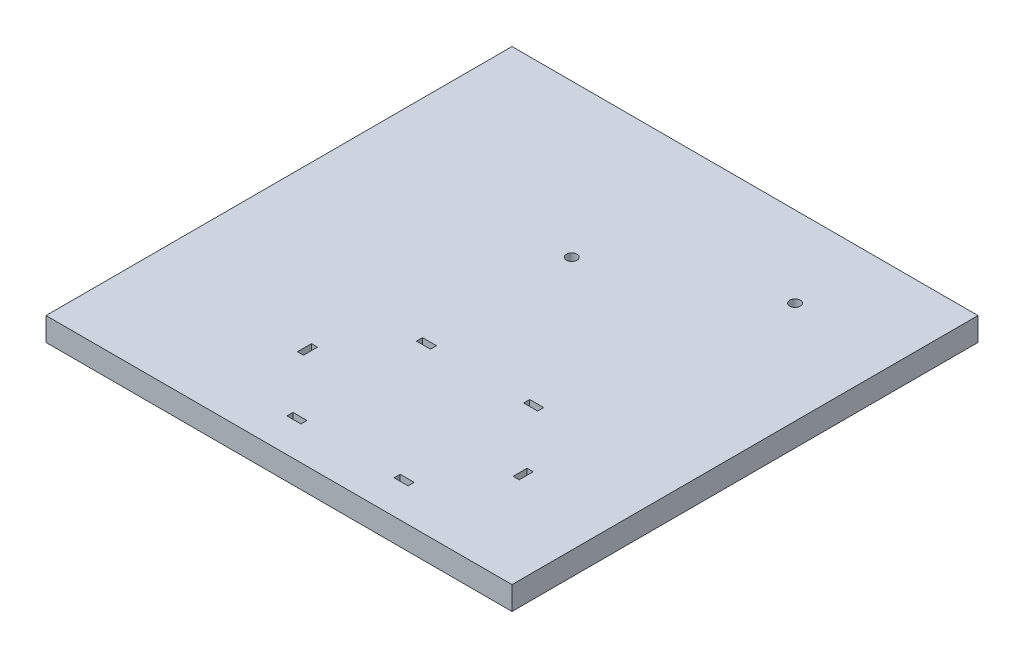
from build123d import *

# Parameters (mm, degrees)
SKETCH1_W           = 100
SKETCH1_H           = 100
SKETCH1_R           = 1.13
SKETCH1_W_2         = 3
SKETCH1_H_2         = 1.3
SKETCH1_W_3         = 1.3
SKETCH1_H_3         = 3
BOSS_EXTRUDE1_DEPTH = 5


with BuildPart() as part:
    # Sketch1 → Boss-Extrude1 (new body)
    with BuildSketch(Plane(origin=(0, 0, 0), x_dir=(1, 0, 0), z_dir=(0, 1, 0))):
        Rectangle(SKETCH1_W, SKETCH1_H)
        with Locations(Location((28.07, 32.68, 0), (0, 0, 270))):
            Circle(SKETCH1_R, mode=Mode.SUBTRACT)
        with Locations(Location((-4.44, 17.26, 0), (0, 0, 270))):
            Circle(SKETCH1_R, mode=Mode.SUBTRACT)
        with Locations((-4, -42.15)):
            Rectangle(SKETCH1_W_2, SKETCH1_H_2, mode=Mode.SUBTRACT)
        with Locations((-4, -14.35)):
            Rectangle(SKETCH1_W_2, SKETCH1_H_2, mode=Mode.SUBTRACT)
        with Locations((19, -14.35)):
            Rectangle(SKETCH1_W_2, SKETCH1_H_2, mode=Mode.SUBTRACT)
        with Locations((19, -42.15)):
            Rectangle(SKETCH1_W_2, SKETCH1_H_2, mode=Mode.SUBTRACT)
        with Locations((30.65, -28.25)):
            Rectangle(SKETCH1_W_3, SKETCH1_H_3, mode=Mode.SUBTRACT)
        with Locations((-15.65, -28.25)):
            Rectangle(SKETCH1_W_3, SKETCH1_H_3, mode=Mode.SUBTRACT)
    extrude(amount=BOSS_EXTRUDE1_DEPTH)


solid = part.part
